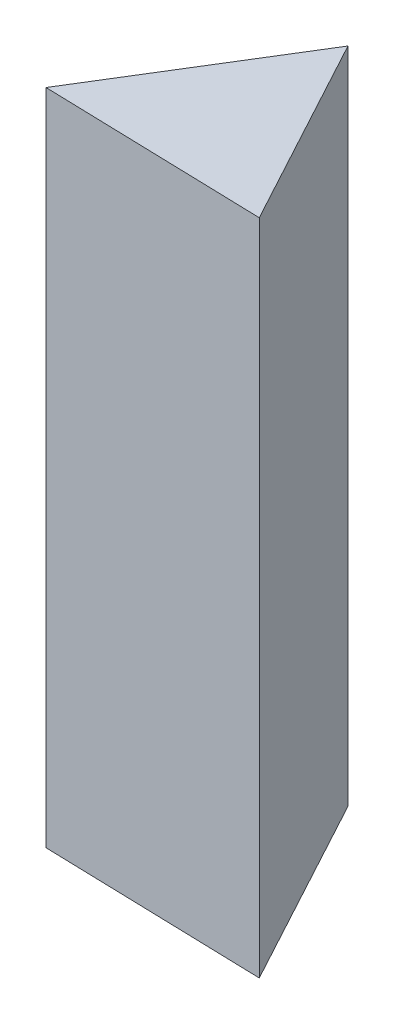
from build123d import *

# Parameters (mm, degrees)
EXTRUDE_1_DEPTH = 75


with BuildPart() as part:
    # 草图1 → 凸台-拉伸1 (new body)
    with BuildSketch(Plane(origin=(0, 0, 0), x_dir=(1, 0, 0), z_dir=(0, 1, 0))):
        Polygon((12.29262896, -7.564694745), (0.404903341, 14.428076331), (-12.697532301, -6.863381586), align=None)
    extrude(amount=EXTRUDE_1_DEPTH)


solid = part.part
